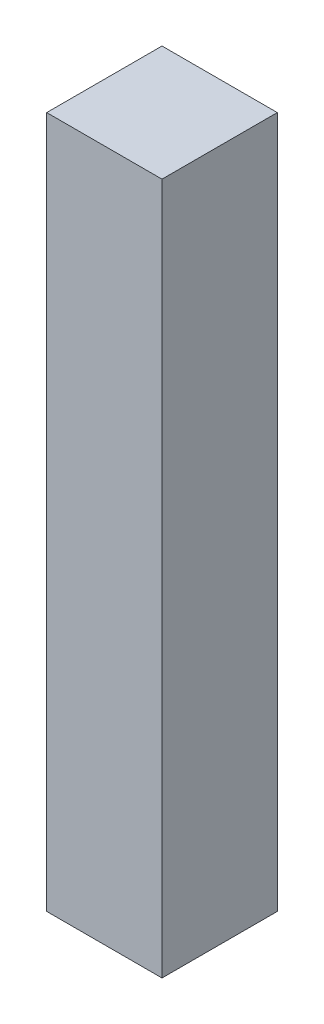
from build123d import *

# Parameters (mm, degrees)
SKETCH1_W           = 101.6
SKETCH1_H           = 101.6
BOSS_EXTRUDE1_DEPTH = 609.6


with BuildPart() as part:
    # Sketch1 → Boss-Extrude1 (new body)
    with BuildSketch(Plane(origin=(0, 0, 0), x_dir=(1, 0, 0), z_dir=(0, 1, 0))):
        with Locations((50.8, -50.8)):
            Rectangle(SKETCH1_W, SKETCH1_H)
    extrude(amount=BOSS_EXTRUDE1_DEPTH)


solid = part.part
